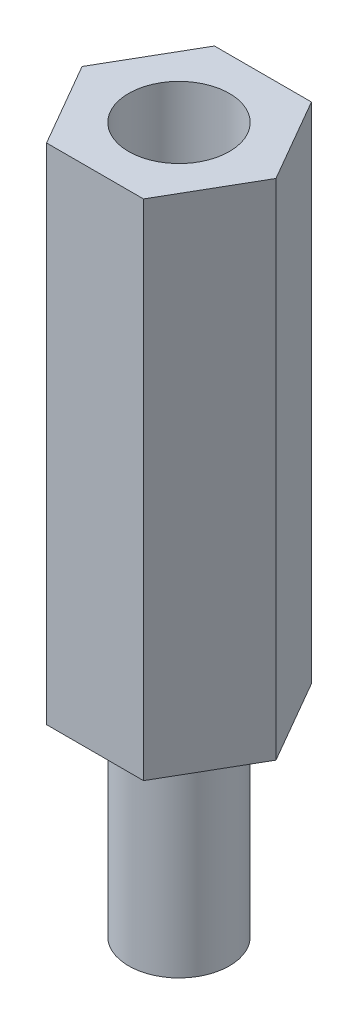
from build123d import *

# Parameters (mm, degrees)
CROQUIS1_R              = 1.5
SALIENTE_EXTRUIR1_DEPTH = 15
CROQUIS2_R              = 1.5
SALIENTE_EXTRUIR2_DEPTH = 6


with BuildPart() as part:
    # Croquis1 → Saliente-Extruir1 (new body)
    with BuildSketch(Plane(origin=(0, 0, 0), x_dir=(1, 0, 0), z_dir=(0, 1, 0))):
        Polygon((1.443375673, -2.5), (2.886751346, 0), (1.443375673, 2.5), (-1.443375673, 2.5), (-2.886751346, 0), (-1.443375673, -2.5), align=None)
        with Locations(Location((0, 0, 0), (0, 0, 270))):
            Circle(CROQUIS1_R, mode=Mode.SUBTRACT)
    extrude(amount=SALIENTE_EXTRUIR1_DEPTH)


with BuildPart() as body_2:
    # Croquis2 → Saliente-Extruir2 (new body)
    with BuildSketch(Plane.XZ):
        with Locations(Location((0, 0, 0), (0, 0, 270))):
            Circle(CROQUIS2_R)
    extrude(amount=SALIENTE_EXTRUIR2_DEPTH)


solid = Compound([part.part, body_2.part])
